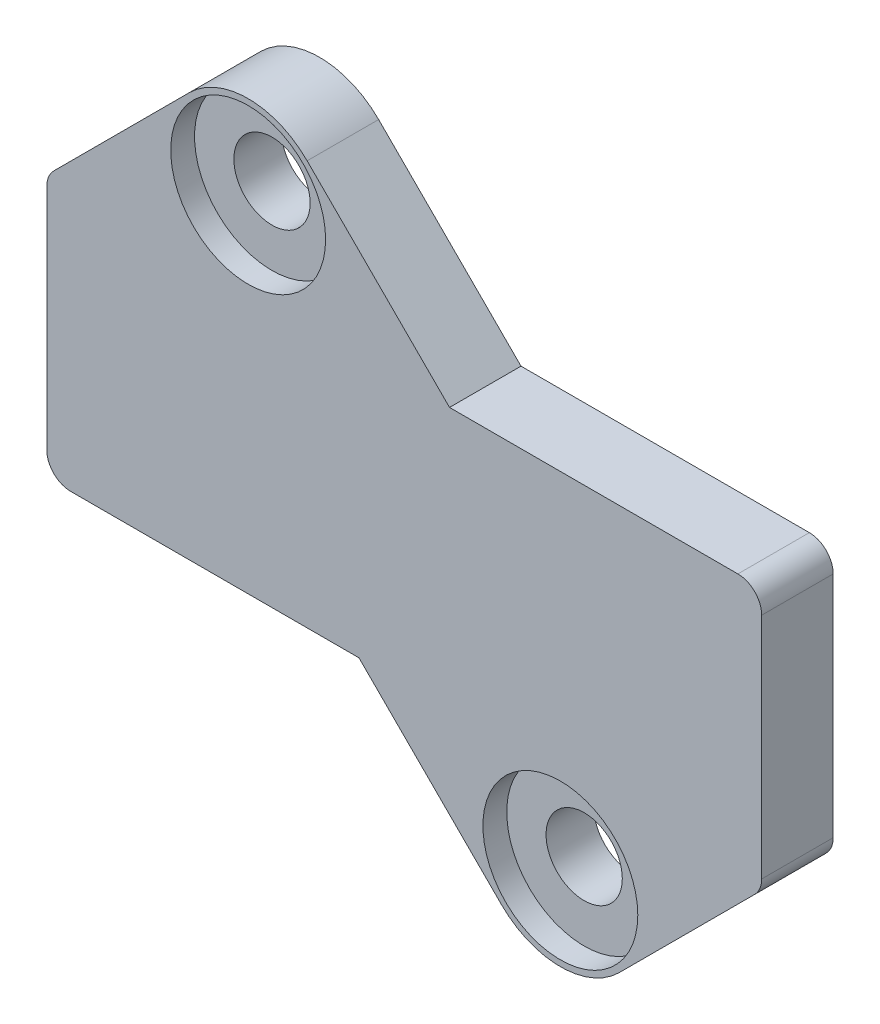
from build123d import *

# Parameters (mm, degrees)
EXTRUDE_1_DEPTH     = 3
SKETCH_3_R          = 3.25
CUT_EXTRUDE_1_DEPTH = 1
FILLET_1_R          = 1
SKETCH_6_R          = 1.6
CUT_EXTRUDE_3_DEPTH = 20.754746265


with BuildPart() as part:
    # 草图1 → 凸台-拉伸1 (new body)
    with BuildSketch(Plane.XY):
        with BuildLine():
            Line((15, 5.5), (1.899494937, 5.5))
            Line((1.899494937, 5.5), (-4.075378798, 11.474873734))
            ThreePointArc((-4.075378798, 11.474873734), (-6.550252532, 12.5), (-9.025126266, 11.474873734))
            Line((-9.025126266, 11.474873734), (-15, 5.5))
            Line((-15, 5.5), (-15, -5.5))
            Line((-15, -5.5), (-1.899494937, -5.5))
            Line((-1.899494937, -5.5), (4.075378798, -11.474873734))
            ThreePointArc((4.075378798, -11.474873734), (6.550252532, -12.5), (9.025126266, -11.474873734))
            Line((9.025126266, -11.474873734), (15, -5.5))
            Line((15, -5.5), (15, 5.5))
        make_face()
    extrude(amount=EXTRUDE_1_DEPTH)

    # 草图3 → 切除-拉伸1 (cut)
    with BuildSketch(Plane.XY.offset(3)):
        with Locations((-6.550252532, 9)):
            Circle(SKETCH_3_R)
        with Locations((6.550252532, -9)):
            Circle(SKETCH_3_R)
    extrude(amount=-CUT_EXTRUDE_1_DEPTH, mode=Mode.SUBTRACT)

    # 圆角1
    fillet_1_edges = [part.edges().sort_by_distance(p)[0] for p in [
        (15, -5.5, 1.5),
        (-15, -5.5, 1.5),
        (-15, 5.5, 1.5),
        (15, 5.5, 1.5),
    ]]
    fillet(fillet_1_edges, radius=FILLET_1_R)

    # 草图6 → 切除-拉伸3 (cut, through all)
    with BuildSketch(Plane.XY.offset(3)):
        with Locations((-6.550252532, 9)):
            Circle(SKETCH_6_R)
        with Locations((6.550252532, -9)):
            Circle(SKETCH_6_R)
    extrude(amount=-CUT_EXTRUDE_3_DEPTH, mode=Mode.SUBTRACT)


solid = part.part
